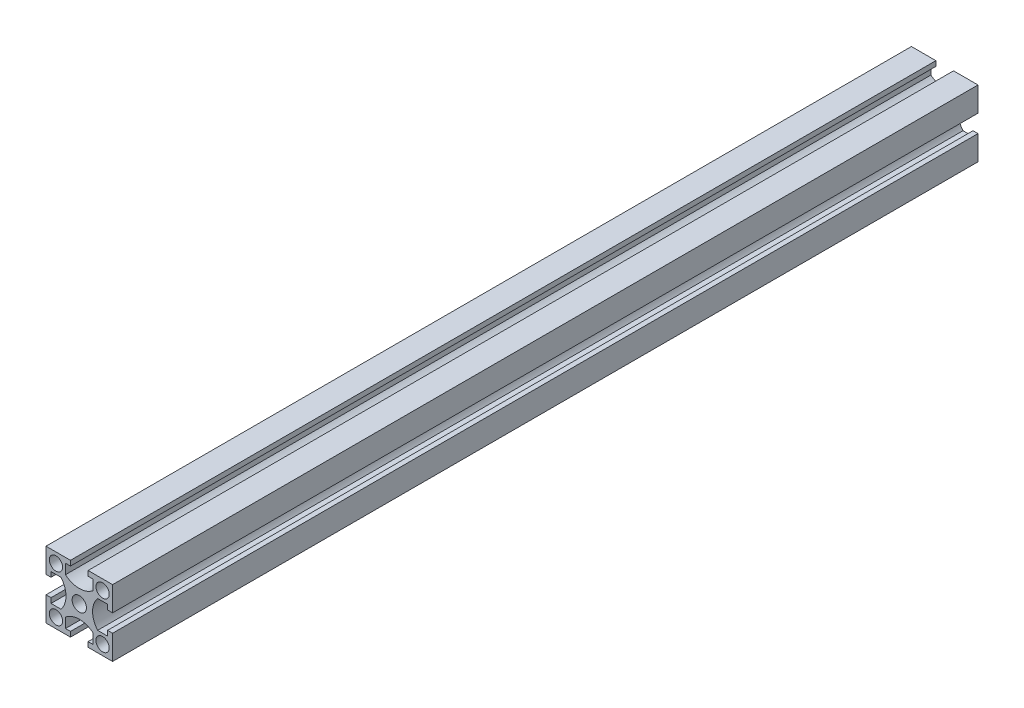
from build123d import *

# Parameters (mm, degrees)
SKETCH_1_W          = 20
SKETCH_1_H          = 20
EXTRUDE_1_DEPTH     = 260
SKETCH_2_R          = 2.15
SKETCH_2_R_2        = 2
CUT_EXTRUDE_1_DEPTH = 261.384331326


with BuildPart() as part:
    # 스케치1 → 보스-돌출1 (new body)
    with BuildSketch(Plane.XY):
        Rectangle(SKETCH_1_W, SKETCH_1_H)
    extrude(amount=EXTRUDE_1_DEPTH)

    # 스케치2 → 컷-돌출1 (cut, through all)
    with BuildSketch(Plane.XY.offset(260)):
        Circle(SKETCH_2_R)
        with Locations((-7, 7)):
            Circle(SKETCH_2_R_2)
        with Locations((7, 7)):
            Circle(SKETCH_2_R_2)
        with Locations((7, -7)):
            Circle(SKETCH_2_R_2)
        with Locations((-7, -7)):
            Circle(SKETCH_2_R_2)
        with BuildLine():
            Line((-2.65, 10), (-2.65, 8.5))
            Line((-2.65, 8.5), (-4.15, 8.5))
            Line((-4.15, 8.5), (-4.15, 5.5))
            ThreePointArc((-4.15, 5.5), (0, 4), (4.15, 5.5))
            Line((4.15, 5.5), (4.15, 8.5))
            Line((4.15, 8.5), (2.65, 8.5))
            Line((2.65, 8.5), (2.65, 10))
            Line((2.65, 10), (-2.65, 10))
        make_face()
        with BuildLine():
            Line((10, 2.65), (8.5, 2.65))
            Line((8.5, 2.65), (8.5, 4.15))
            Line((8.5, 4.15), (5.5, 4.15))
            ThreePointArc((5.5, 4.15), (4, 0), (5.5, -4.15))
            Line((5.5, -4.15), (8.5, -4.15))
            Line((8.5, -4.15), (8.5, -2.65))
            Line((8.5, -2.65), (10, -2.65))
            Line((10, -2.65), (10, 2.65))
        make_face()
        with BuildLine():
            Line((2.65, -10), (2.65, -8.5))
            Line((2.65, -8.5), (4.15, -8.5))
            Line((4.15, -8.5), (4.15, -5.5))
            ThreePointArc((4.15, -5.5), (0, -4), (-4.15, -5.5))
            Line((-4.15, -5.5), (-4.15, -8.5))
            Line((-4.15, -8.5), (-2.65, -8.5))
            Line((-2.65, -8.5), (-2.65, -10))
            Line((-2.65, -10), (2.65, -10))
        make_face()
        with BuildLine():
            Line((-10, -2.65), (-8.5, -2.65))
            Line((-8.5, -2.65), (-8.5, -4.15))
            Line((-8.5, -4.15), (-5.5, -4.15))
            ThreePointArc((-5.5, -4.15), (-4, 0), (-5.5, 4.15))
            Line((-5.5, 4.15), (-8.5, 4.15))
            Line((-8.5, 4.15), (-8.5, 2.65))
            Line((-8.5, 2.65), (-10, 2.65))
            Line((-10, 2.65), (-10, -2.65))
        make_face()
    extrude(amount=-CUT_EXTRUDE_1_DEPTH, mode=Mode.SUBTRACT)


solid = part.part
